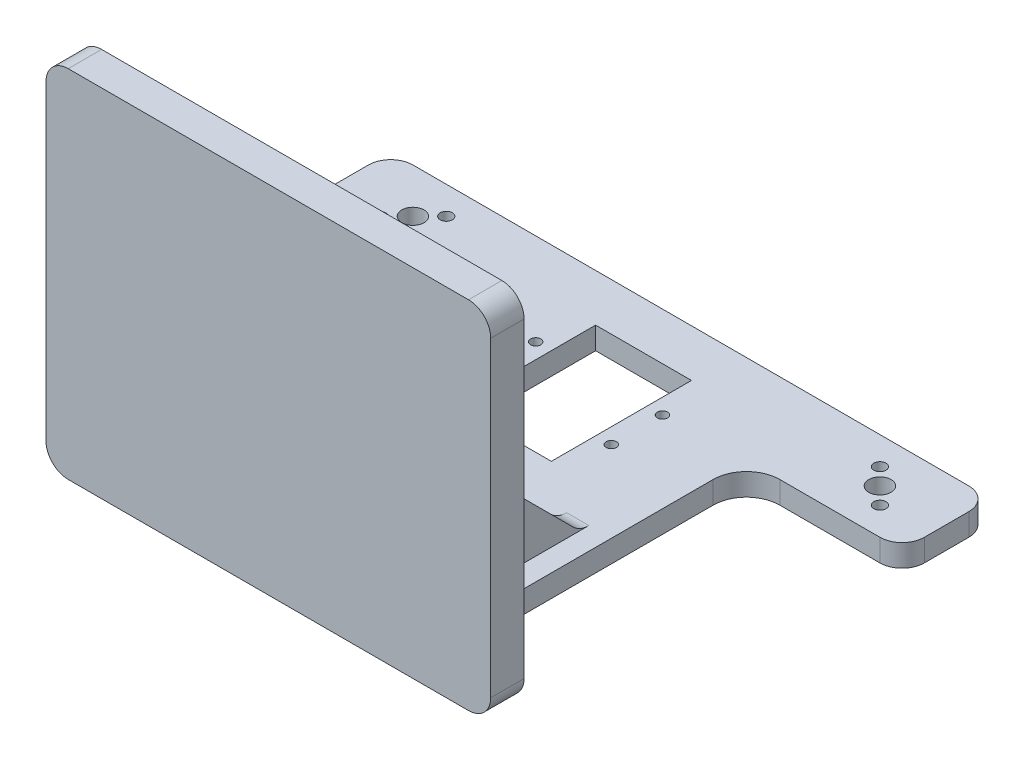
from build123d import *

# Parameters (mm, degrees)
SKIZZE1_R                       = 5
SKIZZE1_R_2                     = 2.75
SKIZZE1_R_3                     = 2.3
SKIZZE1_W                       = 43.1
SKIZZE1_H                       = 63
AUFSATZ_LINEAR_AUSTRAGEN1_DEPTH = 10
SKIZZE3_W                       = 200
SKIZZE3_H                       = 15
AUFSATZ_LINEAR_AUSTRAGEN2_DEPTH = 150
VERRUNDUNG1_R                   = 10
AUFSATZ_LINEAR_AUSTRAGEN3_DEPTH = 10
AUFSATZ_LINEAR_AUSTRAGEN4_DEPTH = 10
VERRUNDUNG2_R                   = 10


with BuildPart() as part:
    # Skizze1 → Aufsatz-Linear austragen1 (new body)
    with BuildSketch(Plane(origin=(0, 0, 0), x_dir=(1, 0, 0), z_dir=(0, 1, 0))):
        with BuildLine():
            Line((-125, 95), (125, 95))
            ThreePointArc((125, 95), (132.071067812, 92.071067812), (135, 85))
            Line((135, 85), (135, 65))
            ThreePointArc((135, 65), (132.071067812, 57.928932188), (125, 55))
            Line((125, 55), (80, 55))
            ThreePointArc((80, 55), (69.393398282, 50.606601718), (65, 40))
            Line((65, 40), (65, -65))
            ThreePointArc((65, -65), (69.393398282, -75.606601718), (80, -80))
            Line((80, -80), (90, -80))
            Line((90, -80), (100, -80))
            Line((100, -80), (100, -95))
            Line((100, -95), (80, -95))
            Line((80, -95), (-80, -95))
            Line((-80, -95), (-100, -95))
            Line((-100, -95), (-100, -80))
            Line((-100, -80), (-90, -80))
            Line((-90, -80), (-80, -80))
            ThreePointArc((-80, -80), (-69.393398282, -75.606601718), (-65, -65))
            Line((-65, -65), (-65, 40))
            ThreePointArc((-65, 40), (-69.393398282, 50.606601718), (-80, 55))
            Line((-80, 55), (-125, 55))
            ThreePointArc((-125, 55), (-132.071067812, 57.928932188), (-135, 65))
            Line((-135, 65), (-135, 85))
            ThreePointArc((-135, 85), (-132.071067812, 92.071067812), (-125, 95))
        make_face()
        with Locations(Location((-105, 75, 0), (0, 0, 270))):
            Circle(SKIZZE1_R, mode=Mode.SUBTRACT)
        with Locations(Location((105, 75, 0), (0, 0, 90))):
            Circle(SKIZZE1_R, mode=Mode.SUBTRACT)
        with Locations(Location((-97.5, 82.5, 0), (0, 0, 270))):
            Circle(SKIZZE1_R_2, mode=Mode.SUBTRACT)
        with Locations(Location((-112.5, 67.5, 0), (0, 0, 270))):
            Circle(SKIZZE1_R_2, mode=Mode.SUBTRACT)
        with Locations(Location((97.5, 82.5, 0), (0, 0, 90))):
            Circle(SKIZZE1_R_2, mode=Mode.SUBTRACT)
        with Locations(Location((112.5, 67.5, 0), (0, 0, 90))):
            Circle(SKIZZE1_R_2, mode=Mode.SUBTRACT)
        with Locations(Location((-28.5, 53.71, 0), (0, 0, 270))):
            Circle(SKIZZE1_R_3, mode=Mode.SUBTRACT)
        with Locations(Location((-28.5, 30.71, 0), (0, 0, 90))):
            Circle(SKIZZE1_R_3, mode=Mode.SUBTRACT)
        with Locations(Location((28.5, 30.71, 0), (0, 0, 270))):
            Circle(SKIZZE1_R_3, mode=Mode.SUBTRACT)
        with Locations(Location((28.5, 53.71, 0), (0, 0, 90))):
            Circle(SKIZZE1_R_3, mode=Mode.SUBTRACT)
        with Locations((0, 42.21)):
            Rectangle(SKIZZE1_W, SKIZZE1_H, mode=Mode.SUBTRACT)
    extrude(amount=AUFSATZ_LINEAR_AUSTRAGEN1_DEPTH)

    # Skizze3 → Aufsatz-Linear austragen2 (add)
    with BuildSketch(Plane(origin=(0, 10, 0), x_dir=(1, 0, 0), z_dir=(0, 1, 0))):
        with Locations((0, -87.5)):
            Rectangle(SKIZZE3_W, SKIZZE3_H)
    extrude(amount=AUFSATZ_LINEAR_AUSTRAGEN2_DEPTH)

    # Verrundung1
    verrundung1_edges = [part.edges().sort_by_distance(p)[0] for p in [
        (-100, 160, 87.5),
        (100, 160, 87.5),
        (100, 0, 87.5),
        (-100, 0, 87.5),
    ]]
    fillet(verrundung1_edges, radius=VERRUNDUNG1_R)

    # Skizze5 → Aufsatz-Linear austragen3 (add)
    with BuildSketch(Plane.ZY.offset(50)):
        Polygon((10, 10), (80, 80), (80, 10), align=None)
    extrude(amount=-AUFSATZ_LINEAR_AUSTRAGEN3_DEPTH)

    # Skizze6 → Aufsatz-Linear austragen4 (add)
    with BuildSketch(Plane(origin=(55, 0, 0), x_dir=(0, 0, -1), z_dir=(1, 0, 0))):
        Polygon((-10, 10), (-80, 80), (-80, 10), align=None)
    extrude(amount=-AUFSATZ_LINEAR_AUSTRAGEN4_DEPTH)

    # Verrundung2
    verrundung2_edges = [part.edges().sort_by_distance(p)[0] for p in [
        (-45, 10, 10),
        (-45, 80, 80),
        (50, 10, 10),
        (50, 80, 80),
    ]]
    fillet(verrundung2_edges, radius=VERRUNDUNG2_R)


solid = part.part
